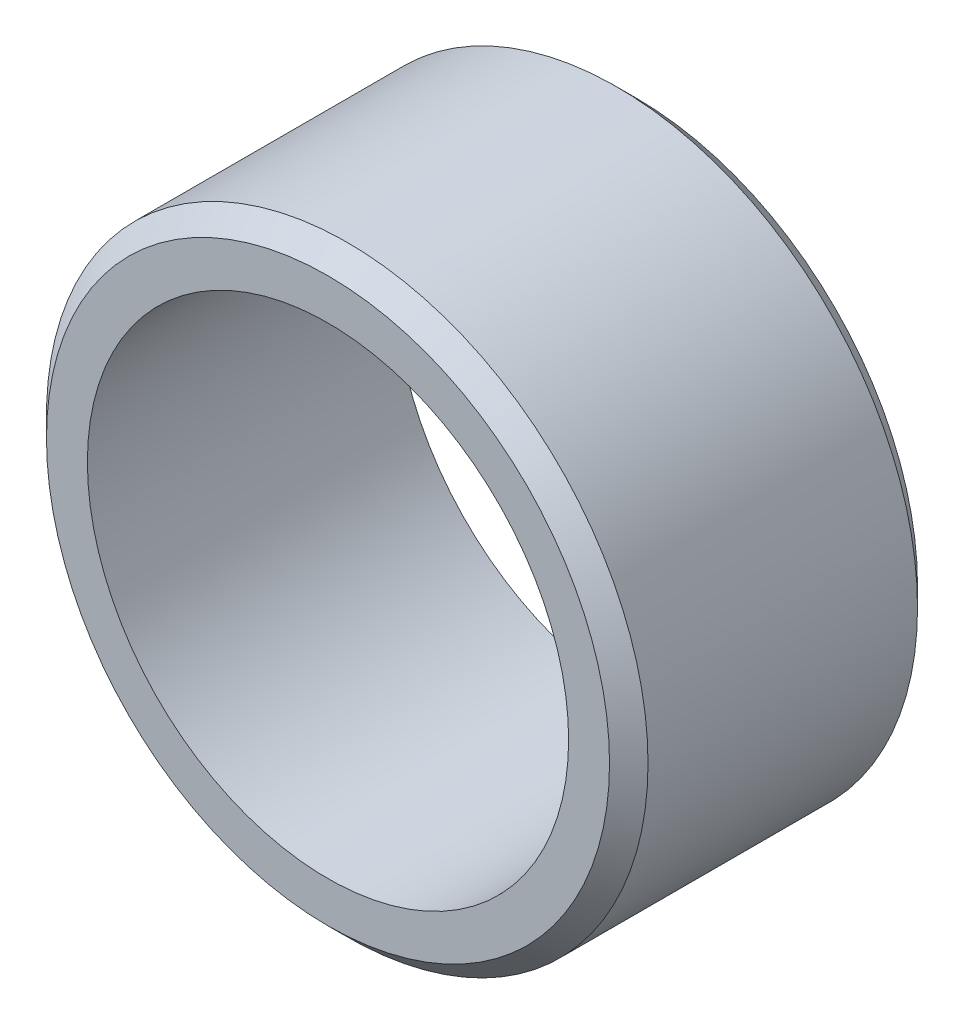
from build123d import *

# Parameters (mm, degrees)
SKETCH1_R           = 7.9375
SKETCH1_R_2         = 6.35
BOSS_EXTRUDE1_DEPTH = 8.128
CHAMFER1_SIZE       = 0.508


with BuildPart() as part:
    # Sketch1 → Boss-Extrude1 (new body)
    with BuildSketch(Plane.XY):
        Circle(SKETCH1_R)
        Circle(SKETCH1_R_2, mode=Mode.SUBTRACT)
    extrude(amount=BOSS_EXTRUDE1_DEPTH)

    # Chamfer1
    chamfer1_edges = [part.edges().sort_by_distance(p)[0] for p in [
        (-7.9375, 0, 0),
        (-7.9375, 0, 8.128),
    ]]
    chamfer(chamfer1_edges, length=CHAMFER1_SIZE)


solid = part.part
